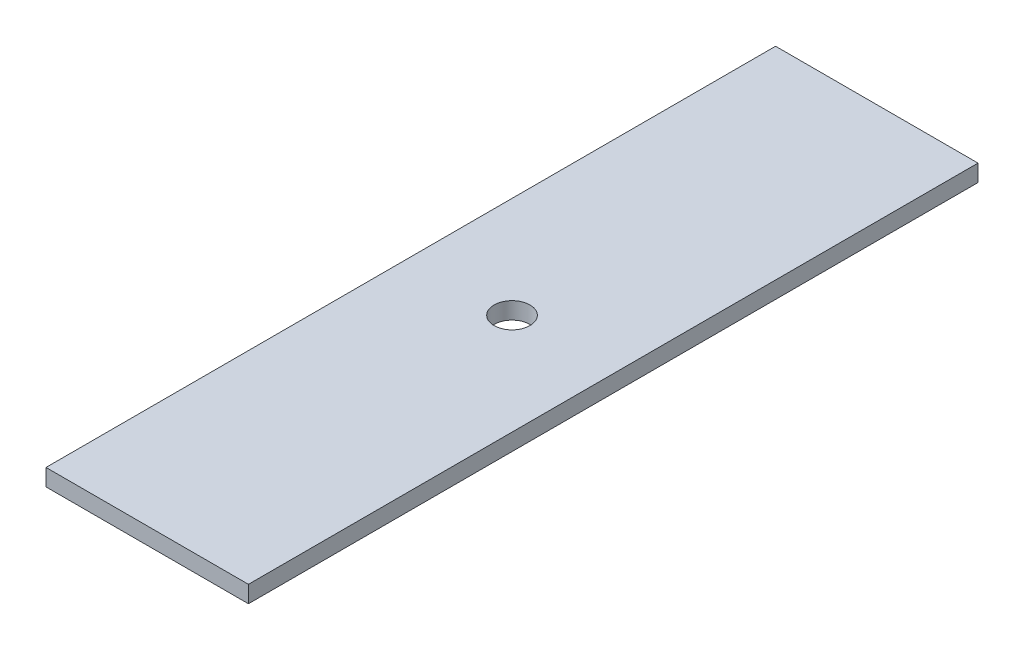
from build123d import *

# Parameters (mm, degrees)
SKETCH1_W           = 76.2
SKETCH1_H           = 274.6375
BOSS_EXTRUDE1_DEPTH = 6.35
SKETCH2_R           = 6.74624
CUT_EXTRUDE1_DEPTH  = 143.647718529


with BuildPart() as part:
    # Sketch1 → Boss-Extrude1 (new body)
    with BuildSketch(Plane(origin=(0, 0, 0), x_dir=(1, 0, 0), z_dir=(0, 1, 0))):
        Rectangle(SKETCH1_W, SKETCH1_H)
    extrude(amount=BOSS_EXTRUDE1_DEPTH)

    # Sketch2 → Cut-Extrude1 (cut, through all)
    with BuildSketch(Plane.XZ):
        with Locations(Location((0, 0, 0), (0, 0, 270))):
            Circle(SKETCH2_R)
    extrude(amount=-CUT_EXTRUDE1_DEPTH, mode=Mode.SUBTRACT)


solid = part.part
